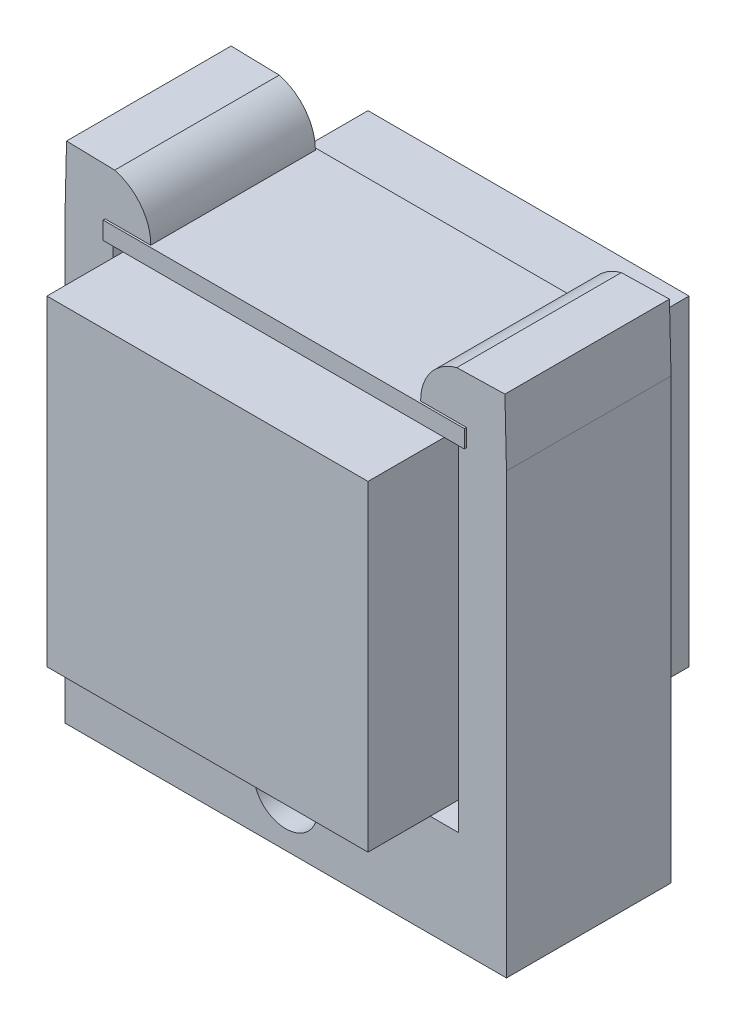
from build123d import *

# Parameters (mm, degrees)
SKETCH1_W                            = 45
SKETCH1_H                            = 21
BOSS_EXTRUDE1_DEPTH                  = 2.2
SKETCH2_W                            = 40
SKETCH2_H                            = 40
BOSS_EXTRUDE2_DEPTH                  = 40
SKETCH3_W                            = 43
SKETCH3_H                            = 12.7
SKETCH3_R                            = 4
SNAPFIT_43MM_SPACING_6MM_WIDTH_DEPTH = 10.25


with BuildPart() as part:
    # Sketch1 → Boss-Extrude1 (new body)
    with BuildSketch(Plane(origin=(0, 0, 0), x_dir=(1, 0, 0), z_dir=(0, 1, 0))):
        Rectangle(SKETCH1_W, SKETCH1_H)
    extrude(amount=BOSS_EXTRUDE1_DEPTH)


with BuildPart() as body_2:
    # Sketch2 → Boss-Extrude2 (new body)
    with BuildSketch(Plane(origin=(0, 0, 0), x_dir=(1, 0, 0), z_dir=(0, 1, 0))):
        Rectangle(SKETCH2_W, SKETCH2_H)
    extrude(amount=-BOSS_EXTRUDE2_DEPTH)


with BuildPart() as body_3:
    # Sketch3 → SnapFit-43mm_spacing-6mm_width (new, symmetric)
    # profile 1 of 3: a face of its own
    with BuildSketch(Plane.XY):
        with Locations((0, -48.35)):
            Rectangle(SKETCH3_W, SKETCH3_H)
        with Locations((0, -48.35)):
            Circle(SKETCH3_R, mode=Mode.SUBTRACT)
    # profile 2 of 3: a face of its own
    with BuildSketch(Plane.XY):
        with BuildLine():
            Line((-27.5, -54.7), (-21.5, -54.7))
            Line((-21.5, -54.7), (-21.5, -42))
            Line((-21.5, -42), (-21.5, 0))
            Line((-21.5, 0), (-21.447633889, 2.199376682))
            Line((-21.447633889, 2.199376682), (-16.806517178, 2.088873903))
            ThreePointArc((-16.806517178, 2.088873903), (-18.018012188, 5.855186341), (-21.306517178, 8.054860057))
            Line((-21.306517178, 8.054860057), (-27.304817221, 8.197676725))
            Line((-27.304817221, 8.197676725), (-27.5, 0))
            Line((-27.5, 0), (-27.5, -54.7))
        make_face()
    # profile 3 of 3: a face of its own
    with BuildSketch(Plane.XY):
        with BuildLine():
            Line((21.5, -42), (21.5, -54.7))
            Line((21.5, -54.7), (27.5, -54.7))
            Line((27.5, -54.7), (27.5, 0))
            Line((27.5, 0), (27.304817221, 8.197676725))
            Line((27.304817221, 8.197676725), (21.306517178, 8.054860057))
            ThreePointArc((21.306517178, 8.054860057), (18.018012188, 5.855186341), (16.806517178, 2.088873903))
            Line((16.806517178, 2.088873903), (21.447633889, 2.199376682))
            Line((21.447633889, 2.199376682), (21.5, 0))
            Line((21.5, 0), (21.5, -42))
        make_face()
    extrude(amount=SNAPFIT_43MM_SPACING_6MM_WIDTH_DEPTH, both=True)


solid = Compound([part.part, body_2.part, body_3.part])
